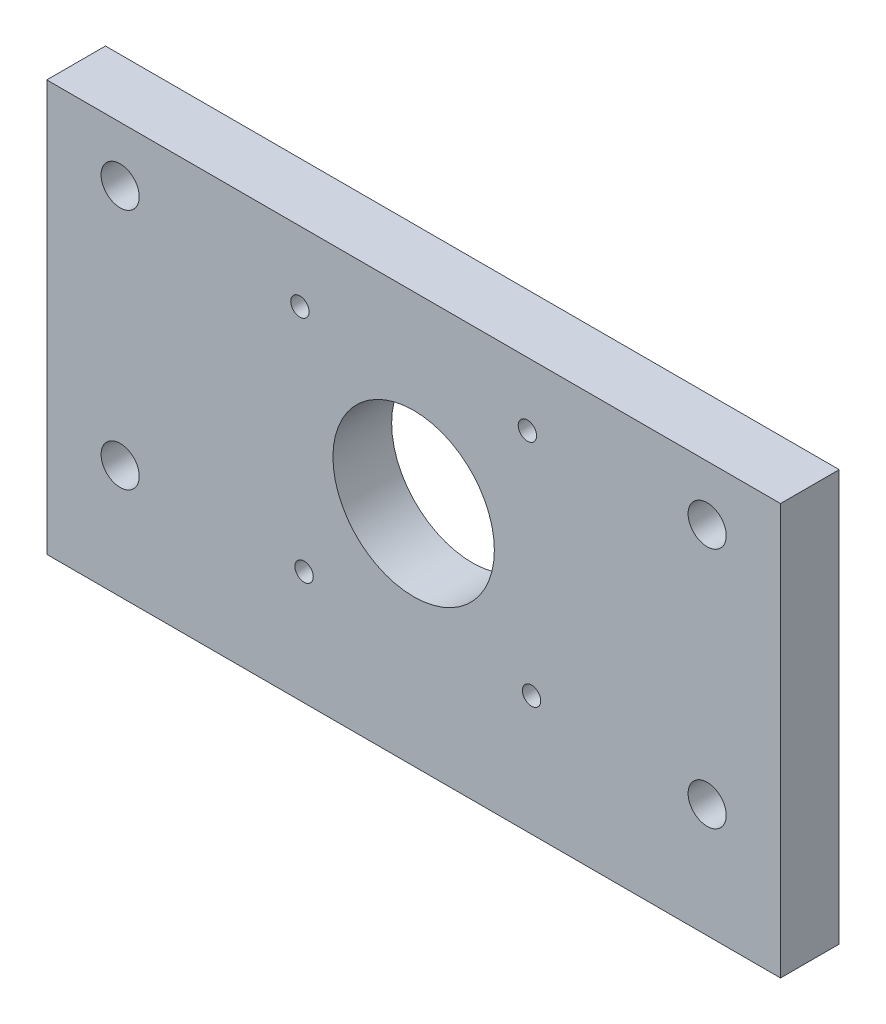
from build123d import *

# Parameters (mm, degrees)
IZIM1_W                     = 100
IZIM1_H                     = 56
IZIM1_R                     = 2.883504547
Y_KSEKLIK_EKSTR_ZYON1_DEPTH = 8
IZIM2_R                     = 11
IZIM2_R_2                   = 1.25
KES_EKSTR_ZYON1_DEPTH       = 10
IZIM3_R                     = 2.6
KES_EKSTR_ZYON2_DEPTH       = 10


with BuildPart() as part:
    # Çizim1 → Yükseklik-Ekstrüzyon1 (new body)
    with BuildSketch(Plane.XY):
        with Locations((7.377917159, -1.029772329)):
            Rectangle(IZIM1_W, IZIM1_H)
        with Locations((7.377917159, 1.970227671)):
            Circle(IZIM1_R, mode=Mode.SUBTRACT)
    extrude(amount=Y_KSEKLIK_EKSTR_ZYON1_DEPTH)

    # Çizim2 → Kes-Ekstrüzyon1 (cut)
    with BuildSketch(Plane(origin=(0, 0, 0), x_dir=(-1, 0, 0), z_dir=(0, 0, -1))):
        with Locations((-7.377917159, 1.970227671)):
            Circle(IZIM2_R)
        with Locations((8.122082841, 17.470227671)):
            Circle(IZIM2_R_2)
        with Locations((7.553397723, -13.529772329)):
            Circle(IZIM2_R_2)
        with Locations((-23.446602277, -12.670089489)):
            Circle(IZIM2_R_2)
        with Locations((-22.877917159, 18.329910511)):
            Circle(IZIM2_R_2)
    extrude(amount=-KES_EKSTR_ZYON1_DEPTH, mode=Mode.SUBTRACT)

    # Çizim3 → Kes-Ekstrüzyon2 (cut)
    with BuildSketch(Plane.XY.offset(8)):
        with Locations((-32.622082841, 19.470227671)):
            Circle(IZIM3_R)
        with Locations((47.377917159, 19.470227671)):
            Circle(IZIM3_R)
        with Locations((47.377917159, -13.529772329)):
            Circle(IZIM3_R)
        with Locations((-32.622082841, -13.529772329)):
            Circle(IZIM3_R)
    extrude(amount=-KES_EKSTR_ZYON2_DEPTH, mode=Mode.SUBTRACT)


solid = part.part
